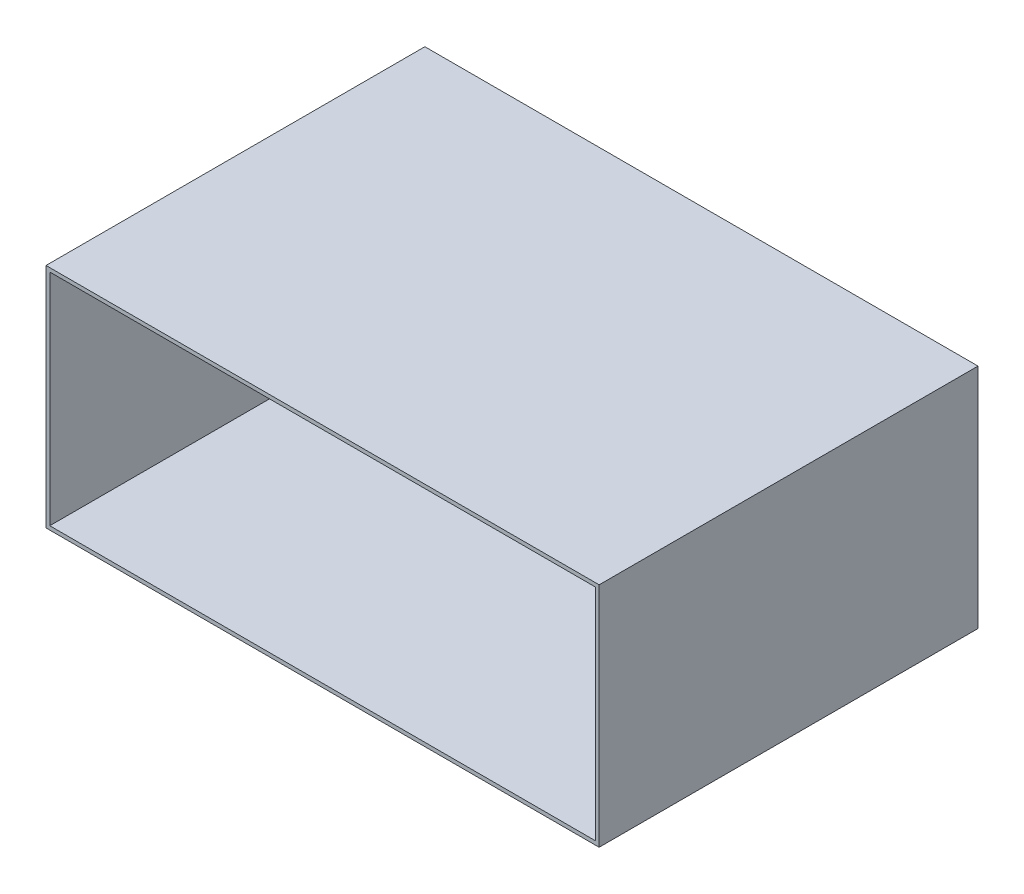
from build123d import *

# Parameters (mm, degrees)
SKETCH1_W           = 73
SKETCH1_H           = 30
SKETCH1_W_2         = 72
SKETCH1_H_2         = 29
BOSS_EXTRUDE1_DEPTH = 50


with BuildPart() as part:
    # Sketch1 → Boss-Extrude1 (new body)
    with BuildSketch(Plane.XY):
        with Locations((-42.261782018, 48.733022026)):
            Rectangle(SKETCH1_W, SKETCH1_H)
        with Locations((-42.261782018, 48.733022026)):
            Rectangle(SKETCH1_W_2, SKETCH1_H_2, mode=Mode.SUBTRACT)
    extrude(amount=BOSS_EXTRUDE1_DEPTH)


solid = part.part
